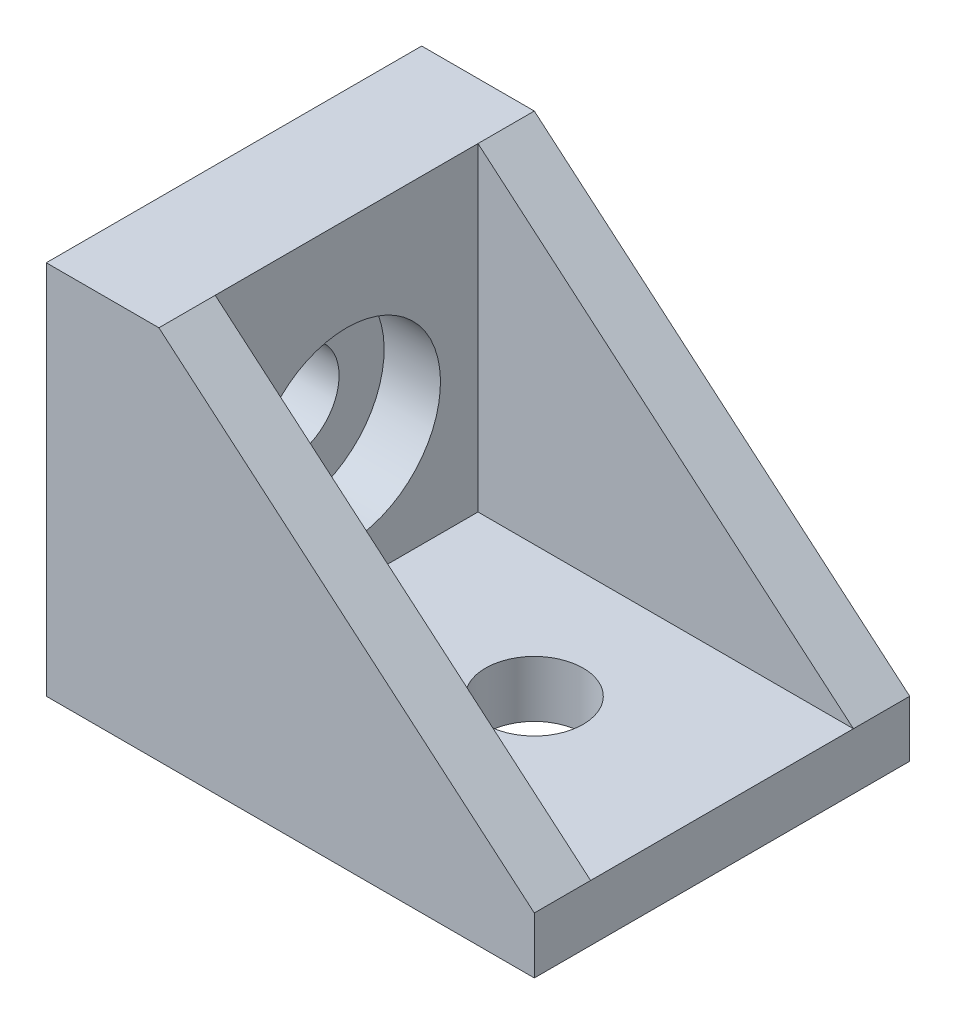
from build123d import *

# Parameters (mm, degrees)
SKETCH_1_W          = 40
SKETCH_1_H          = 20
EXTRUDE_1_DEPTH     = 20
SKETCH_2_W          = 34
SKETCH_2_H          = 14
CUT_EXTRUDE_1_DEPTH = 20
CUT_EXTRUDE_2_DEPTH = 20
SKETCH_5_R          = 5
CUT_EXTRUDE_3_DEPTH = 3
SKETCH_6_W          = 34
SKETCH_6_H          = 20
CUT_EXTRUDE_4_DEPTH = 3
SKETCH_7_W          = 14
SKETCH_7_H          = 20
CUT_EXTRUDE_5_DEPTH = 3
EXTRUDE_2_DEPTH     = 3
EXTRUDE_3_DEPTH     = 3


with BuildPart() as part:
    # 草图1 → 凸台-拉伸1 (new body)
    with BuildSketch(Plane(origin=(0, 0, 0), x_dir=(1, 0, 0), z_dir=(0, 1, 0))):
        with Locations((20, 10)):
            Rectangle(SKETCH_1_W, SKETCH_1_H)
    extrude(amount=EXTRUDE_1_DEPTH)

    # 草图2 → 切除-拉伸1 (cut)
    with BuildSketch(Plane.XY):
        with Locations((23, 13)):
            Rectangle(SKETCH_2_W, SKETCH_2_H)
    extrude(amount=-CUT_EXTRUDE_1_DEPTH, mode=Mode.SUBTRACT)

    # 草图4 → 切除-拉伸2 (cut)
    with BuildSketch(Plane.ZY):
        with BuildLine():
            ThreePointArc((-7.4, 10), (-9.005023076, 12.402086785), (-11.838477631, 11.838477631))
            Line((-11.838477631, 11.838477631), (-8.161522369, 8.161522369))
            ThreePointArc((-8.161522369, 8.161522369), (-7.597913215, 9.005023076), (-7.4, 10))
        make_face()
        with BuildLine():
            Line((-8.161522369, 8.161522369), (-11.838477631, 11.838477631))
            ThreePointArc((-11.838477631, 11.838477631), (-11.838477631, 8.161522369), (-8.161522369, 8.161522369))
        make_face()
    extrude(amount=-CUT_EXTRUDE_2_DEPTH, mode=Mode.SUBTRACT)

    # 草图5 → 切除-拉伸3 (cut)
    with BuildSketch(Plane(origin=(6, 0, 0), x_dir=(0, 0, -1), z_dir=(1, 0, 0))):
        with Locations(Location((10, 10, 0), (0, 0, 90))):
            Circle(SKETCH_5_R)
    extrude(amount=-CUT_EXTRUDE_3_DEPTH, mode=Mode.SUBTRACT)

    # 草图6 → 切除-拉伸4 (cut)
    with BuildSketch(Plane(origin=(0, 6, 0), x_dir=(1, 0, 0), z_dir=(0, 1, 0))):
        with Locations((23, 10)):
            Rectangle(SKETCH_6_W, SKETCH_6_H)
    extrude(amount=-CUT_EXTRUDE_4_DEPTH, mode=Mode.SUBTRACT)

    # 草图7 → 切除-拉伸5 (cut)
    with BuildSketch(Plane(origin=(0, 3, 0), x_dir=(1, 0, 0), z_dir=(0, 1, 0))):
        with Locations((33, 10)):
            Rectangle(SKETCH_7_W, SKETCH_7_H)
        with BuildLine():
            ThreePointArc((18.6, 10), (16.994976924, 12.402086785), (14.161522369, 11.838477631))
            Line((14.161522369, 11.838477631), (17.838477631, 8.161522369))
            ThreePointArc((17.838477631, 8.161522369), (18.402086785, 9.005023076), (18.6, 10))
        make_face()
        with BuildLine():
            Line((17.838477631, 8.161522369), (14.161522369, 11.838477631))
            ThreePointArc((14.161522369, 11.838477631), (14.161522369, 8.161522369), (17.838477631, 8.161522369))
        make_face()
    extrude(amount=-CUT_EXTRUDE_5_DEPTH, mode=Mode.SUBTRACT)

    # 草图9 → 凸台-拉伸2 (add)
    with BuildSketch(Plane.XY):
        Polygon((6, 20), (26, 3), (6, 3), align=None)
    extrude(amount=-EXTRUDE_2_DEPTH)

    # 草图10 → 凸台-拉伸3 (add)
    with BuildSketch(Plane(origin=(0, 0, -20), x_dir=(-1, 0, 0), z_dir=(0, 0, -1))):
        Polygon((-26, 3), (-6, 3), (-6, 20), align=None)
    extrude(amount=-EXTRUDE_3_DEPTH)


solid = part.part
